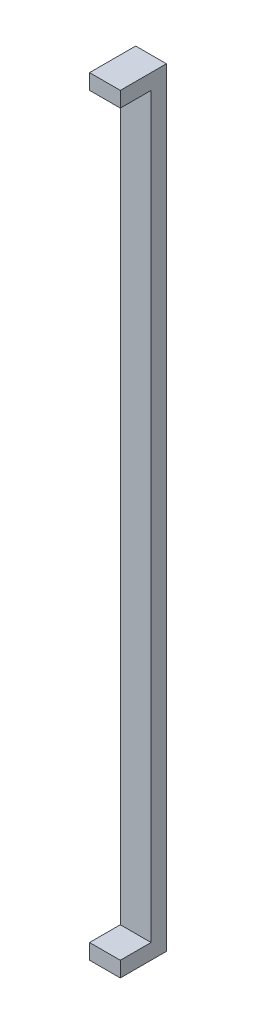
from build123d import *

# Parameters (mm, degrees)
EXTRUDE_1_DEPTH = 40


with BuildPart() as part:
    # Эскиз1 → Бобышка-Вытянуть1 (new body)
    with BuildSketch(Plane(origin=(0, 0, 0), x_dir=(0, 0, -1), z_dir=(1, 0, 0))):
        Polygon((0, 0), (60, 0), (60, 1000), (0, 1000), (0, 980), (40, 980), (40, 20), (0, 20), align=None)
    extrude(amount=EXTRUDE_1_DEPTH)


solid = part.part
